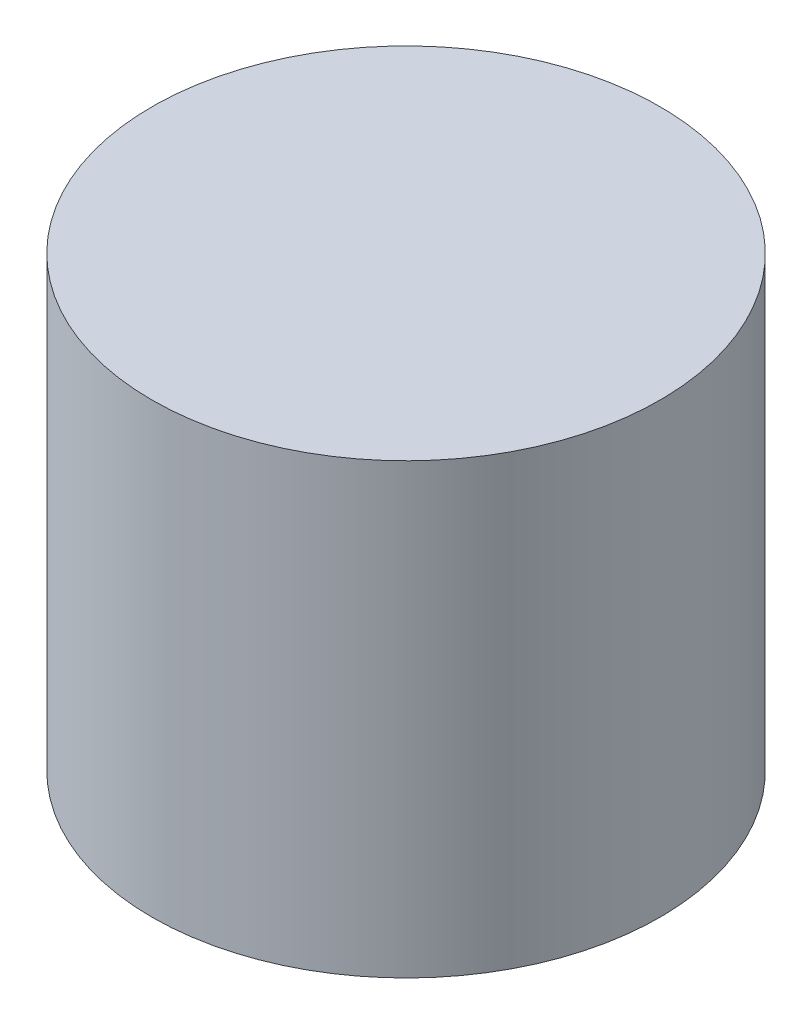
from build123d import *

# Parameters (mm, degrees)
SKETCH3_R           = 28.360772796
BOSS_EXTRUDE4_DEPTH = 50


with BuildPart() as part:
    # Sketch3 → Boss-Extrude4 (new body)
    with BuildSketch(Plane(origin=(0, 0, 0), x_dir=(1, 0, 0), z_dir=(0, 1, 0))):
        Circle(SKETCH3_R)
    extrude(amount=BOSS_EXTRUDE4_DEPTH)


solid = part.part
